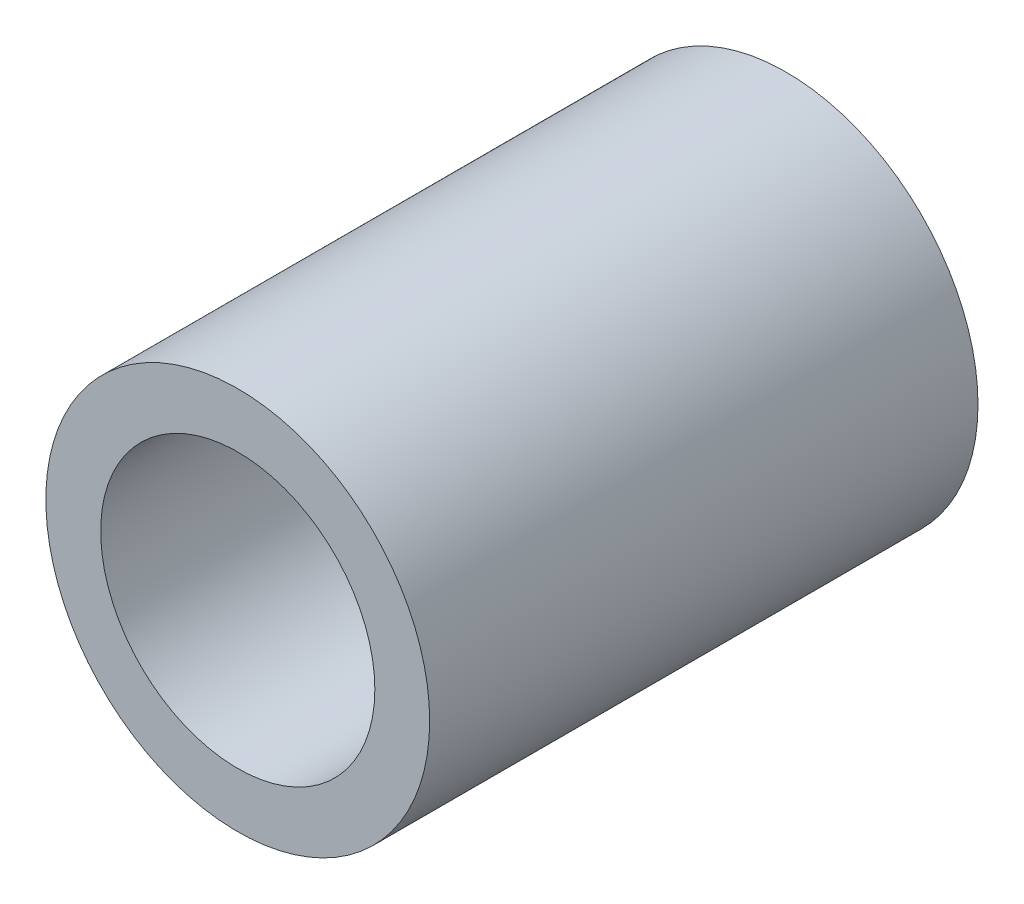
from build123d import *

# Parameters (mm, degrees)
ESQUISSE1_R          = 14
ESQUISSE1_R_2        = 10
BASE_EXTRUSION_DEPTH = 40


with BuildPart() as part:
    # Esquisse1 → Base-Extrusion (new body)
    with BuildSketch(Plane.XY):
        Circle(ESQUISSE1_R)
        Circle(ESQUISSE1_R_2, mode=Mode.SUBTRACT)
    extrude(amount=BASE_EXTRUSION_DEPTH)


solid = part.part
